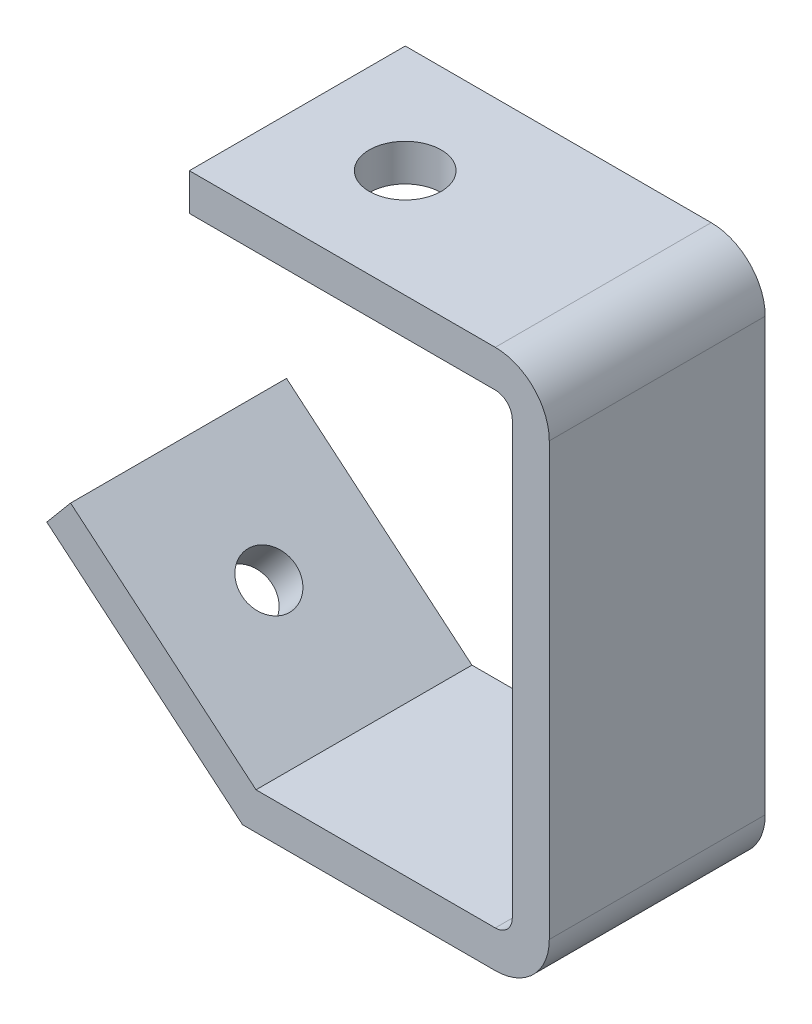
from build123d import *

# Parameters (mm, degrees)
BOSS_EXTRUDE1_DEPTH = 19.05
CUT_EXTRUDE1_REACH  = 118.056
SKETCH2_R           = 6.35
CUT_EXTRUDE2_REACH  = 121.753
SKETCH3_R           = 4.765


with BuildPart() as part:
    # Sketch1 → Boss-Extrude1 (new, symmetric)
    with BuildSketch(Plane.XY):
        with BuildLine():
            Line((0, 0), (53.98, 0))
            ThreePointArc((53.98, 0), (60.718727625, -2.791272375), (63.51, -9.53))
            Line((63.51, -9.53), (63.51, -85.72))
            ThreePointArc((63.51, -85.72), (60.718727625, -92.458727625), (53.98, -95.25))
            Line((53.98, -95.25), (9.39, -95.25))
            Line((9.39, -95.25), (-25.15094394, -66.266706679))
            Line((-25.15094394, -66.266706679), (-20.953540849, -61.264436466))
            Line((-20.953540849, -61.264436466), (11.76672563, -88.72))
            Line((11.76672563, -88.72), (53.98, -88.72))
            ThreePointArc((53.98, -88.72), (56.101320344, -87.841320344), (56.98, -85.72))
            Line((56.98, -85.72), (56.98, -9.53))
            ThreePointArc((56.98, -9.53), (56.101320344, -7.408679656), (53.98, -6.53))
            Line((53.98, -6.53), (0, -6.53))
            Line((0, -6.53), (0, 0))
        make_face()
    extrude(amount=BOSS_EXTRUDE1_DEPTH, both=True)

    # Sketch2 → Cut-Extrude1 (cut, up to next)
    with BuildSketch(Plane(origin=(0, 0, 0), x_dir=(1, 0, 0), z_dir=(0, 1, 0)), mode=Mode.PRIVATE) as cut_extrude1_sk1:
        with Locations(Location((19.04, 0, 0), (0, 0, 270))):
            Circle(SKETCH2_R)
    cut_extrude1_tool1 = extrude(cut_extrude1_sk1.sketch, amount=-CUT_EXTRUDE1_REACH, mode=Mode.PRIVATE) & part.part
    add(cut_extrude1_tool1.solids().sort_by_distance((19.04, 0, 0))[0], mode=Mode.SUBTRACT)

    # Sketch3 → Cut-Extrude2 (cut, up to next)
    with BuildSketch(Plane(origin=(-43.021747431, -51.271322061, 0), x_dir=(0.7660444431189771, -0.6427876096865404, 0), z_dir=(-0.6427876096865404, -0.7660444431189771, 0)), mode=Mode.PRIVATE) as cut_extrude2_sk1:
        with Locations((44.138677144, 0)):
            Circle(SKETCH3_R)
    cut_extrude2_tool1 = extrude(cut_extrude2_sk1.sketch, amount=-CUT_EXTRUDE2_REACH, mode=Mode.PRIVATE) & part.part
    add(cut_extrude2_tool1.solids().sort_by_distance((-9.209559, -79.643117, 0))[0], mode=Mode.SUBTRACT)


solid = part.part
